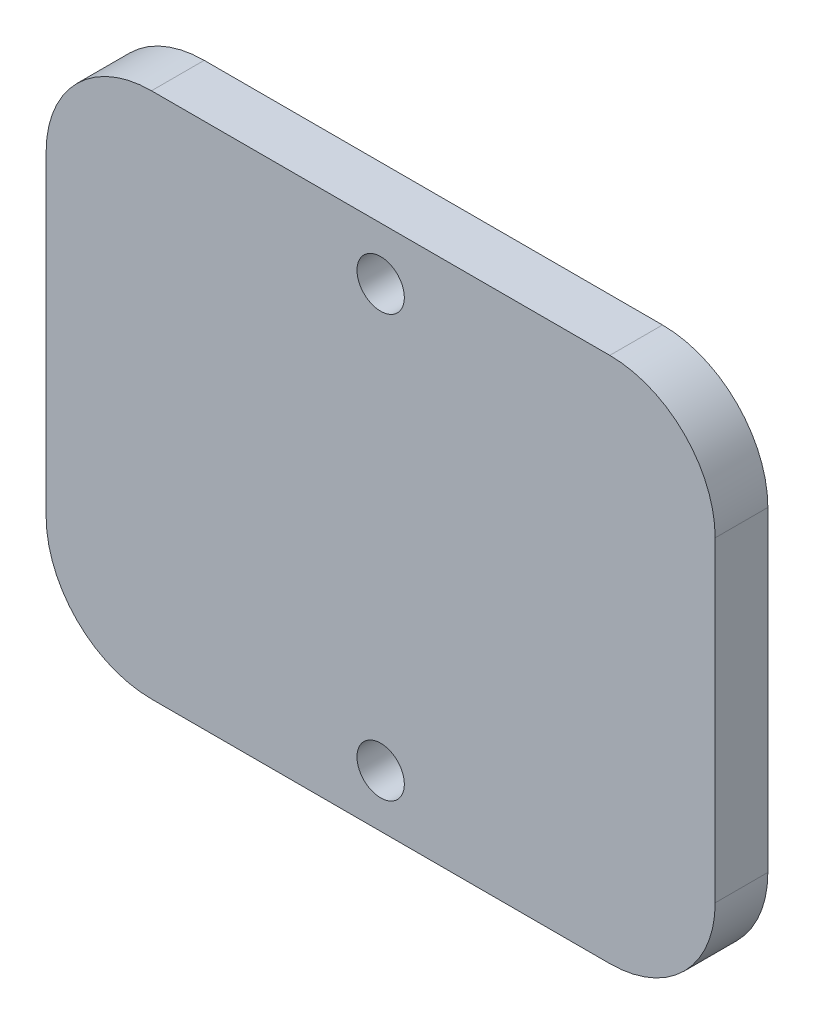
from build123d import *

# Parameters (mm, degrees)
SKETCH1_W           = 63.5
SKETCH1_H           = 50
BOSS_EXTRUDE1_DEPTH = 5
FILLET1_R           = 10
SKETCH9_R           = 2.2479
CUT_EXTRUDE3_DEPTH  = 41.719313599


with BuildPart() as part:
    # Sketch1 → Boss-Extrude1 (new body)
    with BuildSketch(Plane.XY):
        Rectangle(SKETCH1_W, SKETCH1_H)
    extrude(amount=BOSS_EXTRUDE1_DEPTH)

    # Fillet1
    fillet1_edges = [part.edges().sort_by_distance(p)[0] for p in [
        (31.75, -25, 2.5),
        (-31.75, -25, 2.5),
        (-31.75, 25, 2.5),
        (31.75, 25, 2.5),
    ]]
    fillet(fillet1_edges, radius=FILLET1_R)

    # Sketch9 → Cut-Extrude3 (cut, through all)
    with BuildSketch(Plane.XY.offset(5)):
        with Locations((0, 20)):
            Circle(SKETCH9_R)
        with Locations((0, -20)):
            Circle(SKETCH9_R)
    extrude(amount=-CUT_EXTRUDE3_DEPTH, mode=Mode.SUBTRACT)


solid = part.part
